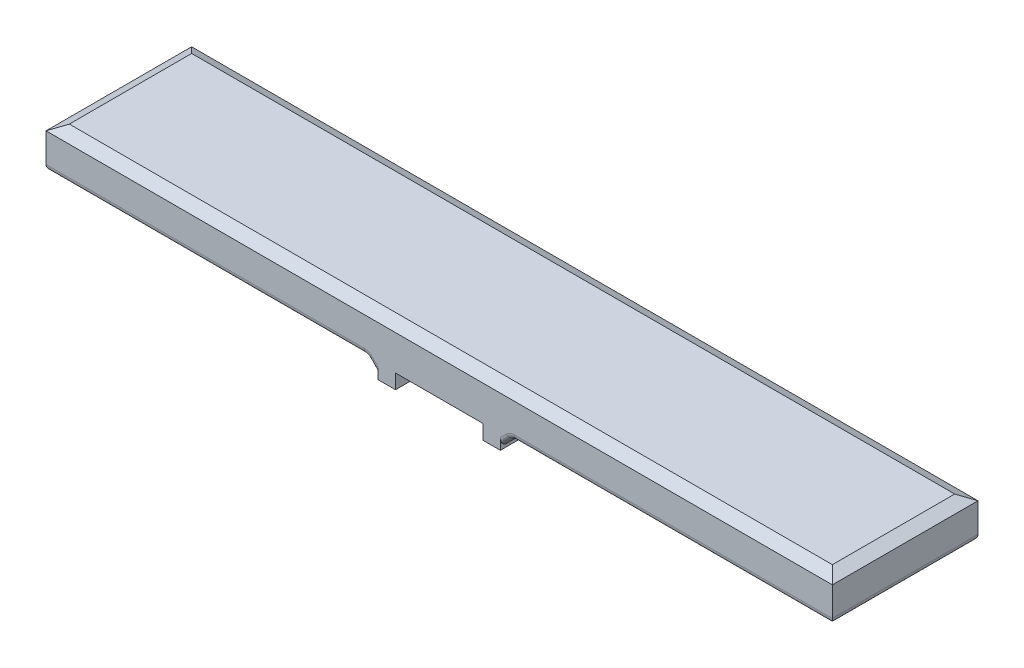
from build123d import *
from OCP.BRepFilletAPI import BRepFilletAPI_MakeChamfer

# Parameters (mm, degrees)
SKETCH1_W           = 1350
SKETCH1_H           = 250
BOSS_EXTRUDE1_DEPTH = 70
CHAMFER1_SIZE       = 10
CHAMFER1_SIZE2      = 20
SKETCH2_W           = 30
SKETCH2_H           = 250
BOSS_EXTRUDE2_DEPTH = 25
CHAMFER2_SIZE       = 20
FILLET1_R           = 10
SKETCH3_R           = 10
BOSS_EXTRUDE3_DEPTH = 25
CHAMFER3_SIZE       = 3


with BuildPart() as part:
    # Sketch1 → Boss-Extrude1 (new body)
    with BuildSketch(Plane(origin=(0, 0, 0), x_dir=(1, 0, 0), z_dir=(0, 1, 0))):
        Rectangle(SKETCH1_W, SKETCH1_H)
    extrude(amount=BOSS_EXTRUDE1_DEPTH)

    # Chamfer1: one chamfer whose edges measure the first distance from different faces: ONE call of the kernel's chamfer builder (chamfer() names one face for all edges)
    chamfer1_edges_1 = [part.edges().sort_by_distance(p)[0] for p in [
        (675, 70, 0),
    ]]
    chamfer1_side_1 = [part.faces().sort_by_distance(p)[0] for p in [
        (675, 35, 0),
    ]]
    chamfer1_edges_2 = [part.edges().sort_by_distance(p)[0] for p in [
        (0, 70, -125),
    ]]
    chamfer1_side_2 = [part.faces().sort_by_distance(p)[0] for p in [
        (0, 35, -125),
    ]]
    chamfer1_edges_3 = [part.edges().sort_by_distance(p)[0] for p in [
        (-675, 70, 0),
    ]]
    chamfer1_side_3 = [part.faces().sort_by_distance(p)[0] for p in [
        (-675, 35, 0),
    ]]
    chamfer1_edges_4 = [part.edges().sort_by_distance(p)[0] for p in [
        (0, 70, 125),
    ]]
    chamfer1_side_4 = [part.faces().sort_by_distance(p)[0] for p in [
        (0, 35, 125),
    ]]
    chamfer1 = BRepFilletAPI_MakeChamfer(part.part.solid().wrapped)
    for e in chamfer1_edges_1:
        chamfer1.Add(CHAMFER1_SIZE, CHAMFER1_SIZE2, e.wrapped, chamfer1_side_1[0].wrapped)  # the first distance lies on this face
    for e in chamfer1_edges_2:
        chamfer1.Add(CHAMFER1_SIZE, CHAMFER1_SIZE2, e.wrapped, chamfer1_side_2[0].wrapped)  # the first distance lies on this face
    for e in chamfer1_edges_3:
        chamfer1.Add(CHAMFER1_SIZE, CHAMFER1_SIZE2, e.wrapped, chamfer1_side_3[0].wrapped)  # the first distance lies on this face
    for e in chamfer1_edges_4:
        chamfer1.Add(CHAMFER1_SIZE, CHAMFER1_SIZE2, e.wrapped, chamfer1_side_4[0].wrapped)  # the first distance lies on this face
    add(Compound.cast(chamfer1.Shape()), mode=Mode.REPLACE)

    # Sketch2 → Boss-Extrude2 (add)
    with BuildSketch(Plane.XZ):
        with Locations((-90, 0)):
            Rectangle(SKETCH2_W, SKETCH2_H)
        with Locations((90, 0)):
            Rectangle(SKETCH2_W, SKETCH2_H)
    extrude(amount=BOSS_EXTRUDE2_DEPTH)

    # Chamfer2
    chamfer2_edges = [part.edges().sort_by_distance(p)[0] for p in [
        (-105, 0, 0),
        (105, 0, 0),
    ]]
    chamfer(chamfer2_edges, length=CHAMFER2_SIZE)

    # Fillet1
    fillet1_edges = [part.edges().sort_by_distance(p)[0] for p in [
        (-400, 0, -125),
        (675, 0, 0),
        (-125, 0, 0),
        (400, 0, -125),
        (400, 0, 125),
        (-400, 0, 125),
        (125, 0, 0),
        (-115, -10, -125),
        (-115, -10, 125),
        (115, -10, 125),
        (115, -10, -125),
        (-675, 0, 0),
    ]]
    fillet(fillet1_edges, radius=FILLET1_R)

    # Sketch3 → Boss-Extrude3 (add)
    with BuildSketch(Plane.XZ):
        with Locations(Location((0, 0, 0), (0, 0, 90))):
            Circle(SKETCH3_R)
    extrude(amount=BOSS_EXTRUDE3_DEPTH)

    # Chamfer3
    chamfer3_edges = [part.edges().sort_by_distance(p)[0] for p in [
        (0, -25, -10),
    ]]
    chamfer(chamfer3_edges, length=CHAMFER3_SIZE)


solid = part.part
